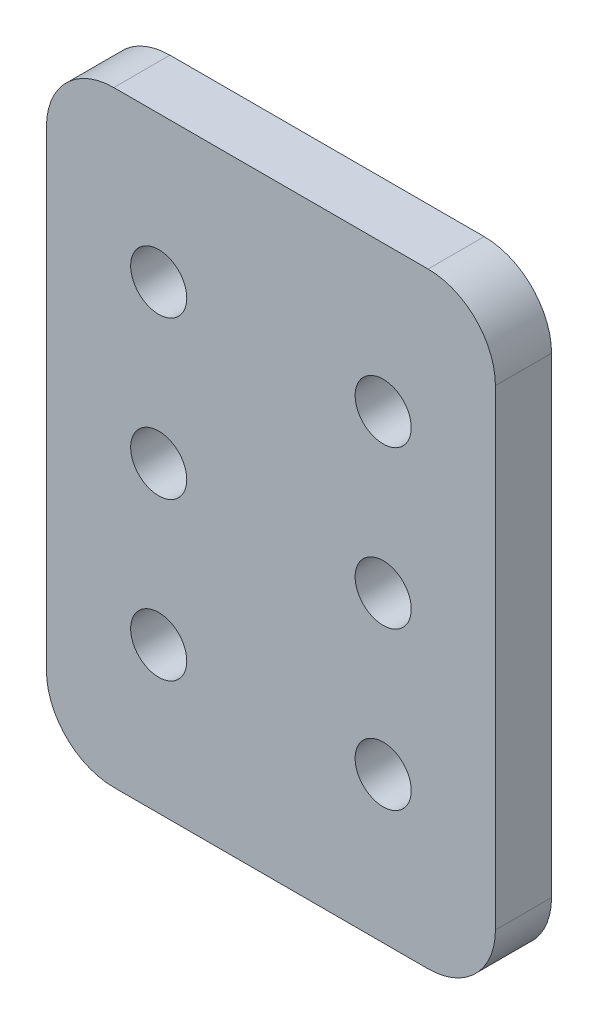
from build123d import *

# Parameters (mm, degrees)
SKETCH2_W           = 50.8
SKETCH2_H           = 68.58
BOSS_EXTRUDE1_DEPTH = 6.35
FILLET1_R           = 7.62
SKETCH5_R           = 3.175
CUT_EXTRUDE1_DEPTH  = 44.142630889
LPATTERN1_COUNT     = 2
LPATTERN1_PITCH     = 17.78
LPATTERN1_COL_COUNT = 2
LPATTERN1_COL_PITCH = 17.78


with BuildPart() as part:
    # Sketch2 → Boss-Extrude1 (new body)
    with BuildSketch(Plane.XY):
        Rectangle(SKETCH2_W, SKETCH2_H)
    extrude(amount=BOSS_EXTRUDE1_DEPTH)

    # Fillet1
    fillet1_edges = [part.edges().sort_by_distance(p)[0] for p in [
        (25.4, -34.29, 3.175),
        (-25.4, -34.29, 3.175),
        (-25.4, 34.29, 3.175),
        (25.4, 34.29, 3.175),
    ]]
    fillet(fillet1_edges, radius=FILLET1_R)

    # Sketch5 → Cut-Extrude1 (cut, through all)
    with BuildSketch(Plane.XY.offset(6.35)):
        with Locations((-12.7, 0)):
            Circle(SKETCH5_R)
        with Locations((12.7, 0)):
            Circle(SKETCH5_R)
    cut_extrude1 = extrude(amount=-CUT_EXTRUDE1_DEPTH, mode=Mode.SUBTRACT)

    # LPattern1: Cut-Extrude1 ×2
    with Locations(*[(0, -i * LPATTERN1_PITCH, 0) for i in range(1, LPATTERN1_COUNT)]):
        add(cut_extrude1, mode=Mode.SUBTRACT)

    # LPattern1 col: Cut-Extrude1 ×2
    with Locations(*[(0, i * LPATTERN1_COL_PITCH, 0) for i in range(1, LPATTERN1_COL_COUNT)]):
        add(cut_extrude1, mode=Mode.SUBTRACT)


solid = part.part
